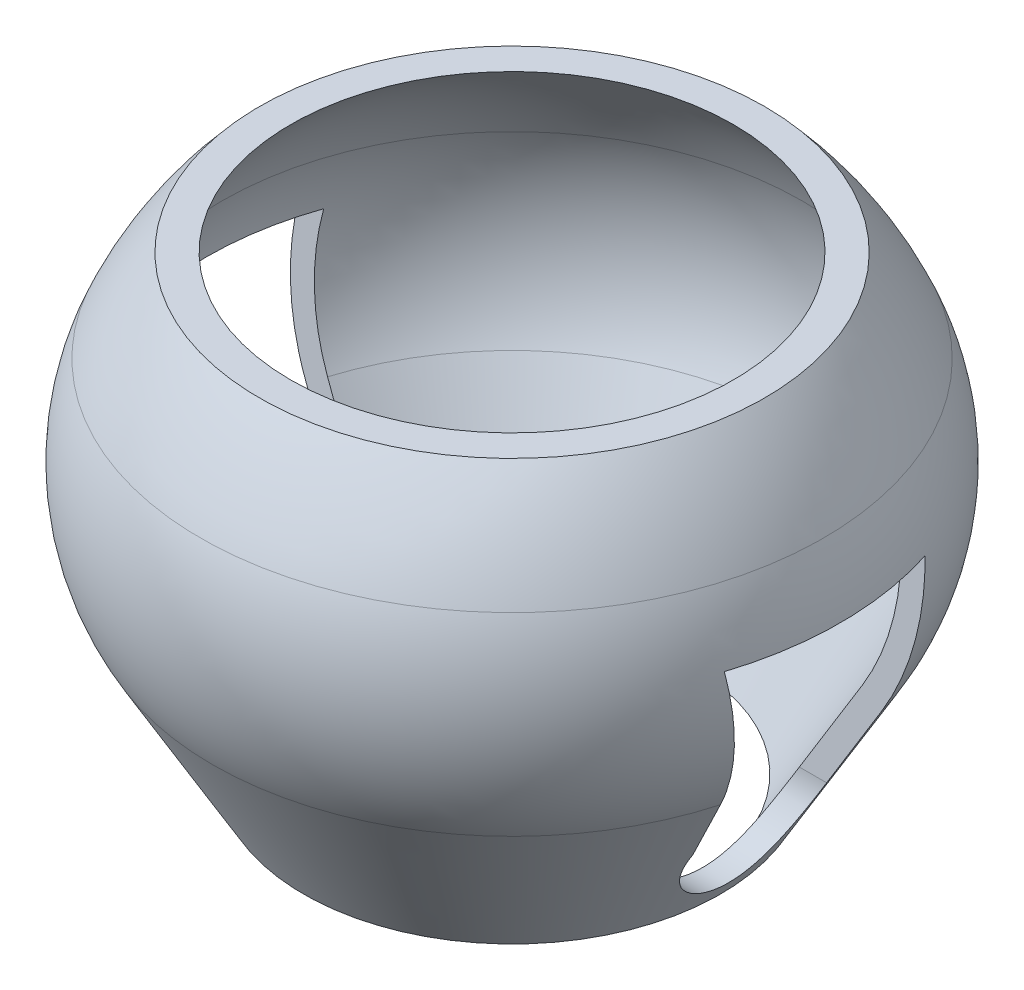
from build123d import *

# Parameters (mm, degrees)
REVOLVE1_ANGLE      = 180
SKETCH8_R           = 7.5
BOSS_EXTRUDE1_DEPTH = 5
BOSS_EXTRUDE1_TAPER = 30
FILLET3_R           = 5
SHELL7_T            = -0.5
CUT_EXTRUDE1_DEPTH  = 23
CUT_EXTRUDE4_DEPTH  = 2.5


with BuildPart() as part:
    # Sketch5 → Revolve1 (revolve)
    with BuildSketch(Plane(origin=(0, 0, 0), x_dir=(1, 0, 0), z_dir=(0, 1, 0))):
        with BuildLine():
            Line((-15, 0), (0, 0))
            ThreePointArc((0, 0), (-7.5, -7.5), (-15, 0))
        make_face()
    revolve(axis=Axis((0, 0, 0), (-1, 0, 0)), revolution_arc=REVOLVE1_ANGLE)

    # Sketch8 → Boss-Extrude1 (add)
    with BuildSketch(Plane.XZ):
        with Locations((-7.5, 0)):
            Circle(SKETCH8_R)
    extrude(amount=BOSS_EXTRUDE1_DEPTH, taper=BOSS_EXTRUDE1_TAPER)

    # Fillet3
    fillet3_edges = [part.edges().sort_by_distance(p)[0] for p in [
        (-7.5, 0, -7.5),
    ]]
    fillet(fillet3_edges, radius=FILLET3_R)

    # Shell7
    shell7_openings = [part.faces().sort_by_distance(p)[0] for p in [
        (-7.5, -5, 0),
    ]]
    offset(amount=SHELL7_T, openings=shell7_openings, kind=Kind.INTERSECTION)

    # Sketch9 → Cut-Extrude1 (cut)
    with BuildSketch(Plane(origin=(0, 0, 0), x_dir=(0, 0, -1), z_dir=(1, 0, 0))):
        with BuildLine():
            Line((1.557300456, -3.245702646), (2.220059838, 1.52969178))
            Line((2.220059838, 1.52969178), (-2.220059838, 1.52969178))
            Line((-2.220059838, 1.52969178), (-1.556069246, -2.994983603))
            ThreePointArc((-1.556069246, -2.994983603), (-0.125361033, -4.684691185), (1.557300456, -3.245702646))
        make_face()
    extrude(amount=-CUT_EXTRUDE1_DEPTH, mode=Mode.SUBTRACT)

    # Sketch11 → Cut-Extrude4 (cut)
    with BuildSketch(Plane(origin=(0, 7.5, 0), x_dir=(1, 0, 0), z_dir=(0, 1, 0))):
        Polygon((-7.5, 6.89001607), (-0.60998393, 6.89001607), (-0.60998393, -6.89001607), (-14.767195706, -6.89001607), (-14.767195706, 0), (-14.767195706, 6.89001607), align=None)
    extrude(amount=-CUT_EXTRUDE4_DEPTH, mode=Mode.SUBTRACT)


solid = part.part
